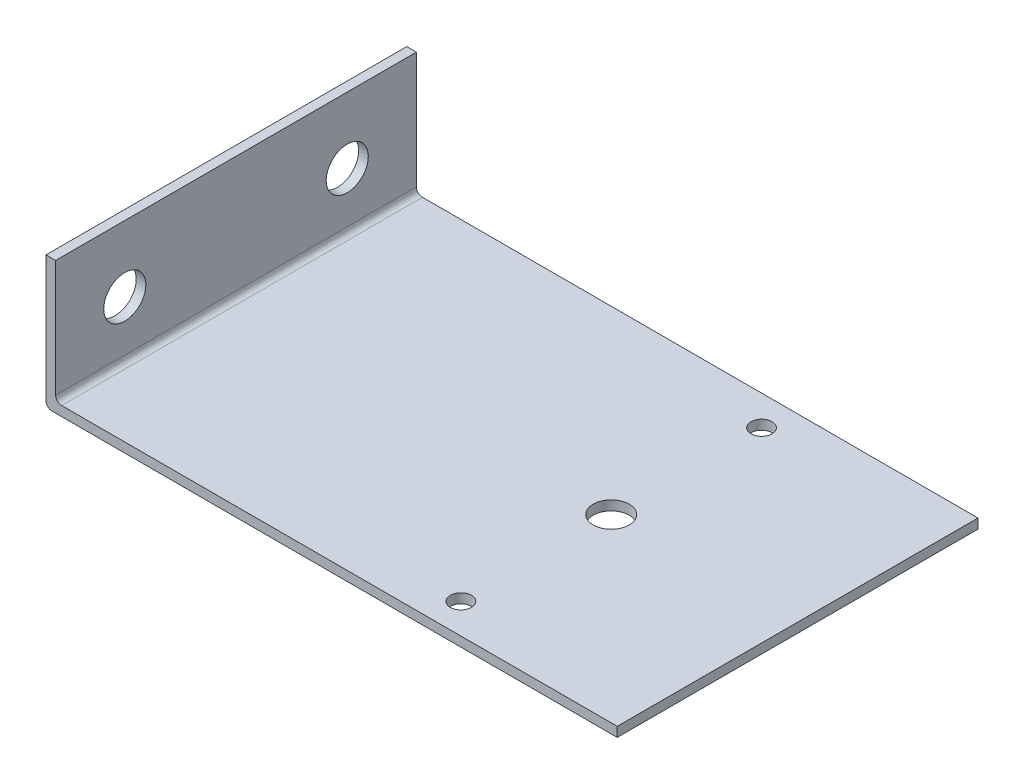
from build123d import *

# Parameters (mm, degrees)
ESTRUSIONE_ESTRUSIONE1_DEPTH = 60
RACCORDO1_R                  = 1
RACCORDO2_R                  = 1
TAGLIO_ESTRUSIONE1_REACH     = 116.198
SCHIZZO2_R                   = 1.75
SCHIZZO2_R_2                 = 3
SCHIZZO3_R                   = 3.5
TAGLIO_ESTRUSIONE2_DEPTH     = 115.494541355


with BuildPart() as part:
    # Schizzo1 → Estrusione-Estrusione1 (new body)
    with BuildSketch(Plane.XY):
        Polygon((-95, 22), (-95, 0), (0, 0), (0, 1.6), (-93.4, 1.6), (-93.4, 22), align=None)
    extrude(amount=ESTRUSIONE_ESTRUSIONE1_DEPTH)

    # Raccordo1
    raccordo1_edges = [part.edges().sort_by_distance(p)[0] for p in [
        (-95, 0, 30),
    ]]
    fillet(raccordo1_edges, radius=RACCORDO1_R)

    # Raccordo2
    raccordo2_edges = [part.edges().sort_by_distance(p)[0] for p in [
        (-93.4, 1.6, 30),
    ]]
    fillet(raccordo2_edges, radius=RACCORDO2_R)

    # Schizzo2 → Taglio-Estrusione1 (cut, up to next)
    with BuildSketch(Plane(origin=(0, 1.6, 0), x_dir=(1, 0, 0), z_dir=(0, 1, 0)), mode=Mode.PRIVATE) as taglio_estrusione1_sk1:
        with Locations(Location((-31, -5, 0), (0, 0, 180))):
            Circle(SCHIZZO2_R)
    taglio_estrusione1_tool1 = extrude(taglio_estrusione1_sk1.sketch, amount=-TAGLIO_ESTRUSIONE1_REACH, mode=Mode.PRIVATE) & part.part
    # Schizzo2 → Taglio-Estrusione1 (cut, up to next)
    with BuildSketch(Plane(origin=(0, 1.6, 0), x_dir=(1, 0, 0), z_dir=(0, 1, 0)), mode=Mode.PRIVATE) as taglio_estrusione1_sk2:
        with Locations(Location((-31, -30, 0), (0, 0, 180))):
            Circle(SCHIZZO2_R_2)
    taglio_estrusione1_tool2 = extrude(taglio_estrusione1_sk2.sketch, amount=-TAGLIO_ESTRUSIONE1_REACH, mode=Mode.PRIVATE) & part.part
    # Schizzo2 → Taglio-Estrusione1 (cut, up to next)
    with BuildSketch(Plane(origin=(0, 1.6, 0), x_dir=(1, 0, 0), z_dir=(0, 1, 0)), mode=Mode.PRIVATE) as taglio_estrusione1_sk3:
        with Locations(Location((-31, -55, 0), (0, 0, 180))):
            Circle(SCHIZZO2_R)
    taglio_estrusione1_tool3 = extrude(taglio_estrusione1_sk3.sketch, amount=-TAGLIO_ESTRUSIONE1_REACH, mode=Mode.PRIVATE) & part.part
    add(taglio_estrusione1_tool1.solids().sort_by_distance((-31, 1.6, 5))[0], mode=Mode.SUBTRACT)
    add(taglio_estrusione1_tool2.solids().sort_by_distance((-31, 1.6, 30))[0], mode=Mode.SUBTRACT)
    add(taglio_estrusione1_tool3.solids().sort_by_distance((-31, 1.6, 55))[0], mode=Mode.SUBTRACT)

    # Schizzo3 → Taglio-Estrusione2 (cut, through all)
    with BuildSketch(Plane.ZY.offset(95)):
        with Locations((11.5, 11)):
            Circle(SCHIZZO3_R)
        with Locations((48.5, 11)):
            Circle(SCHIZZO3_R)
    extrude(amount=-TAGLIO_ESTRUSIONE2_DEPTH, mode=Mode.SUBTRACT)


solid = part.part
